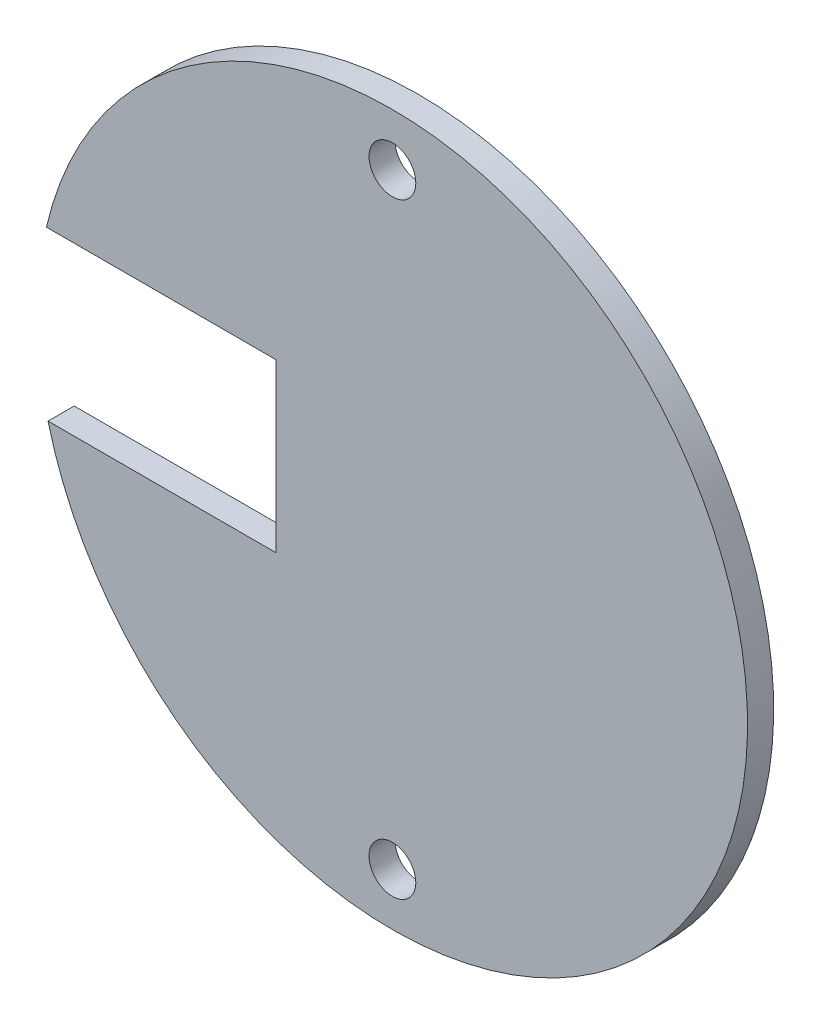
from build123d import *

# Parameters (mm, degrees)
SKETCH2_R           = 1.4224
BOSS_EXTRUDE1_DEPTH = 1.5875


with BuildPart() as part:
    # Sketch2 → Boss-Extrude1 (new body)
    with BuildSketch(Plane.XY):
        with BuildLine():
            Line((-21.031997569, 4.8768), (-7.084965338, 4.8768))
            Line((-7.084965338, 4.8768), (-7.084965338, -5.2832))
            Line((-7.084965338, -5.2832), (-20.933606898, -5.2832))
            ThreePointArc((-20.933606898, -5.2832), (21.588987692, 0.209070373), (-21.031997569, 4.8768))
        make_face()
        with Locations((0, 18.415)):
            Circle(SKETCH2_R, mode=Mode.SUBTRACT)
        with Locations((0, -18.415)):
            Circle(SKETCH2_R, mode=Mode.SUBTRACT)
    extrude(amount=BOSS_EXTRUDE1_DEPTH)


solid = part.part
